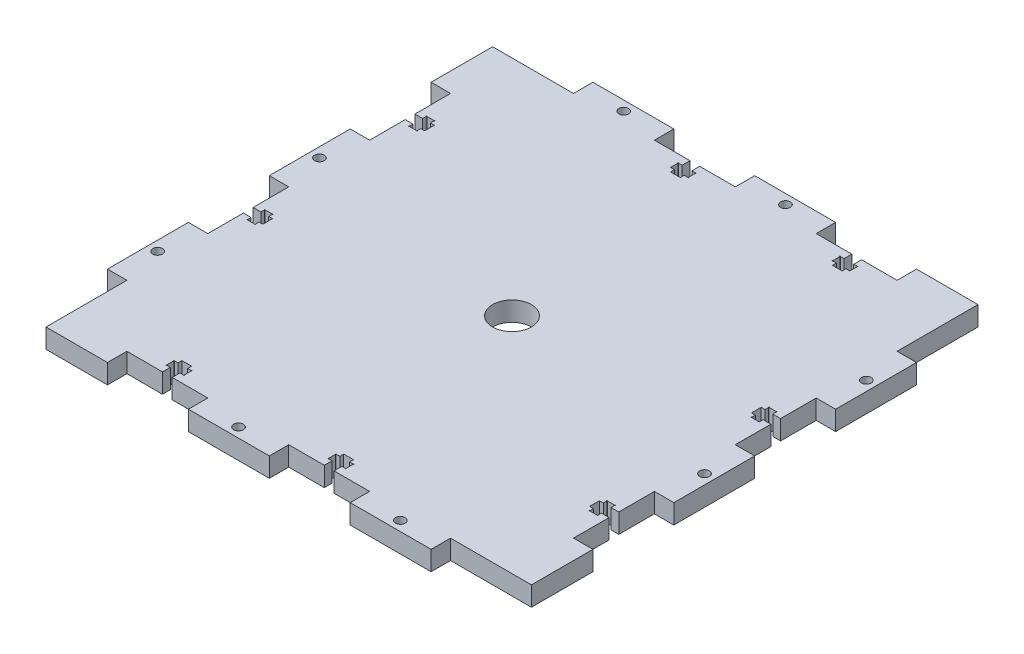
from build123d import *

# Parameters (mm, degrees)
BOSS_EXTRUDE1_DEPTH = 6
SKETCH2_R           = 1.5
CUT_EXTRUDE1_DEPTH  = 107.235587258
SKETCH3_R           = 6
CUT_EXTRUDE2_DEPTH  = 107.235587258


with BuildPart() as part:
    # Sketch1 → Boss-Extrude1 (new body)
    with BuildSketch(Plane(origin=(0, 0, 0), x_dir=(1, 0, 0), z_dir=(0, 1, 0))):
        Polygon((0, 75), (25, 75), (25, 69), (50, 69), (50, 75), (69, 75), (69, 50), (75, 50), (75, 25), (69, 25), (69, 0), (75, 0), (75, -25), (69, -25), (69, -50), (75, -50), (75, -69), (50, -69), (50, -75), (25, -75), (25, -69), (0, -69), (0, -75), (-25, -75), (-25, -69), (-50, -69), (-50, -75), (-69, -75), (-69, -50), (-75, -50), (-75, -25), (-69, -25), (-69, 0), (-75, 0), (-75, 25), (-69, 25), (-69, 50), (-75, 50), (-75, 69), (-50, 69), (-50, 75), (-25, 75), (-25, 69), (0, 69), align=None)
    extrude(amount=BOSS_EXTRUDE1_DEPTH)

    # Sketch2 → Cut-Extrude1 (cut, through all)
    with BuildSketch(Plane(origin=(0, 6, 0), x_dir=(1, 0, 0), z_dir=(0, 1, 0))):
        with Locations(Location((-37.5, 72, 0), (0, 0, 270))):
            Circle(SKETCH2_R)
        with Locations(Location((12.5, 72, 0), (0, 0, 270))):
            Circle(SKETCH2_R)
        with Locations(Location((72, 37.5, 0), (0, 0, 270))):
            Circle(SKETCH2_R)
        with Locations(Location((72, -12.5, 0), (0, 0, 270))):
            Circle(SKETCH2_R)
        with Locations(Location((37.5, -72, 0), (0, 0, 270))):
            Circle(SKETCH2_R)
        with Locations(Location((-12.5, -72, 0), (0, 0, 270))):
            Circle(SKETCH2_R)
        with Locations(Location((-72, -37.5, 0), (0, 0, 270))):
            Circle(SKETCH2_R)
        with Locations(Location((-72, 12.5, 0), (0, 0, 270))):
            Circle(SKETCH2_R)
        with BuildLine():
            Line((-11, 69), (-14, 69))
            Line((-14, 69), (-14, 66.6))
            Line((-14, 66.6), (-15.1, 66.6))
            ThreePointArc((-15.1, 66.6), (-15.270710678, 66.670710678), (-15.2, 66.5))
            Line((-15.2, 66.5), (-15.2, 64.3))
            ThreePointArc((-15.2, 64.3), (-15.270710678, 64.129289322), (-15.1, 64.2))
            Line((-15.1, 64.2), (-14, 64.2))
            Line((-14, 64.2), (-14, 63))
            Line((-14, 63), (-11, 63))
            Line((-11, 63), (-11, 64.2))
            Line((-11, 64.2), (-9.9, 64.2))
            ThreePointArc((-9.9, 64.2), (-9.729289322, 64.129289322), (-9.8, 64.3))
            Line((-9.8, 64.3), (-9.8, 66.5))
            ThreePointArc((-9.8, 66.5), (-9.729289322, 66.670710678), (-9.9, 66.6))
            Line((-9.9, 66.6), (-11, 66.6))
            Line((-11, 66.6), (-11, 69))
        make_face()
        with BuildLine():
            Line((69, 11), (69, 14))
            Line((69, 14), (66.6, 14))
            Line((66.6, 14), (66.6, 15.1))
            ThreePointArc((66.6, 15.1), (66.670710678, 15.270710678), (66.5, 15.2))
            Line((66.5, 15.2), (64.3, 15.2))
            ThreePointArc((64.3, 15.2), (64.129289322, 15.270710678), (64.2, 15.1))
            Line((64.2, 15.1), (64.2, 14))
            Line((64.2, 14), (63, 14))
            Line((63, 14), (63, 11))
            Line((63, 11), (64.2, 11))
            Line((64.2, 11), (64.2, 9.9))
            ThreePointArc((64.2, 9.9), (64.129289322, 9.729289322), (64.3, 9.8))
            Line((64.3, 9.8), (66.5, 9.8))
            ThreePointArc((66.5, 9.8), (66.670710678, 9.729289322), (66.6, 9.9))
            Line((66.6, 9.9), (66.6, 11))
            Line((66.6, 11), (69, 11))
        make_face()
        with BuildLine():
            Line((39, 69), (36, 69))
            Line((36, 69), (36, 66.6))
            Line((36, 66.6), (34.9, 66.6))
            ThreePointArc((34.9, 66.6), (34.729289322, 66.670710678), (34.8, 66.5))
            Line((34.8, 66.5), (34.8, 64.3))
            ThreePointArc((34.8, 64.3), (34.729289322, 64.129289322), (34.9, 64.2))
            Line((34.9, 64.2), (36, 64.2))
            Line((36, 64.2), (36, 63))
            Line((36, 63), (39, 63))
            Line((39, 63), (39, 64.2))
            Line((39, 64.2), (40.1, 64.2))
            ThreePointArc((40.1, 64.2), (40.270710678, 64.129289322), (40.2, 64.3))
            Line((40.2, 64.3), (40.2, 66.5))
            ThreePointArc((40.2, 66.5), (40.270710678, 66.670710678), (40.1, 66.6))
            Line((40.1, 66.6), (39, 66.6))
            Line((39, 66.6), (39, 69))
        make_face()
        with BuildLine():
            Line((69, -39), (69, -36))
            Line((69, -36), (66.6, -36))
            Line((66.6, -36), (66.6, -34.9))
            ThreePointArc((66.6, -34.9), (66.670710678, -34.729289322), (66.5, -34.8))
            Line((66.5, -34.8), (64.3, -34.8))
            ThreePointArc((64.3, -34.8), (64.129289322, -34.729289322), (64.2, -34.9))
            Line((64.2, -34.9), (64.2, -36))
            Line((64.2, -36), (63, -36))
            Line((63, -36), (63, -39))
            Line((63, -39), (64.2, -39))
            Line((64.2, -39), (64.2, -40.1))
            ThreePointArc((64.2, -40.1), (64.129289322, -40.270710678), (64.3, -40.2))
            Line((64.3, -40.2), (66.5, -40.2))
            ThreePointArc((66.5, -40.2), (66.670710678, -40.270710678), (66.6, -40.1))
            Line((66.6, -40.1), (66.6, -39))
            Line((66.6, -39), (69, -39))
        make_face()
        with BuildLine():
            Line((11, -69), (14, -69))
            Line((14, -69), (14, -66.6))
            Line((14, -66.6), (15.1, -66.6))
            ThreePointArc((15.1, -66.6), (15.270710678, -66.670710678), (15.2, -66.5))
            Line((15.2, -66.5), (15.2, -64.3))
            ThreePointArc((15.2, -64.3), (15.270710678, -64.129289322), (15.1, -64.2))
            Line((15.1, -64.2), (14, -64.2))
            Line((14, -64.2), (14, -63))
            Line((14, -63), (11, -63))
            Line((11, -63), (11, -64.2))
            Line((11, -64.2), (9.9, -64.2))
            ThreePointArc((9.9, -64.2), (9.729289322, -64.129289322), (9.8, -64.3))
            Line((9.8, -64.3), (9.8, -66.5))
            ThreePointArc((9.8, -66.5), (9.729289322, -66.670710678), (9.9, -66.6))
            Line((9.9, -66.6), (11, -66.6))
            Line((11, -66.6), (11, -69))
        make_face()
        with BuildLine():
            Line((-39, -69), (-36, -69))
            Line((-36, -69), (-36, -66.6))
            Line((-36, -66.6), (-34.9, -66.6))
            ThreePointArc((-34.9, -66.6), (-34.729289322, -66.670710678), (-34.8, -66.5))
            Line((-34.8, -66.5), (-34.8, -64.3))
            ThreePointArc((-34.8, -64.3), (-34.729289322, -64.129289322), (-34.9, -64.2))
            Line((-34.9, -64.2), (-36, -64.2))
            Line((-36, -64.2), (-36, -63))
            Line((-36, -63), (-39, -63))
            Line((-39, -63), (-39, -64.2))
            Line((-39, -64.2), (-40.1, -64.2))
            ThreePointArc((-40.1, -64.2), (-40.270710678, -64.129289322), (-40.2, -64.3))
            Line((-40.2, -64.3), (-40.2, -66.5))
            ThreePointArc((-40.2, -66.5), (-40.270710678, -66.670710678), (-40.1, -66.6))
            Line((-40.1, -66.6), (-39, -66.6))
            Line((-39, -66.6), (-39, -69))
        make_face()
        with BuildLine():
            Line((-69, 39), (-69, 36))
            Line((-69, 36), (-66.6, 36))
            Line((-66.6, 36), (-66.6, 34.9))
            ThreePointArc((-66.6, 34.9), (-66.670710678, 34.729289322), (-66.5, 34.8))
            Line((-66.5, 34.8), (-64.3, 34.8))
            ThreePointArc((-64.3, 34.8), (-64.129289322, 34.729289322), (-64.2, 34.9))
            Line((-64.2, 34.9), (-64.2, 36))
            Line((-64.2, 36), (-63, 36))
            Line((-63, 36), (-63, 39))
            Line((-63, 39), (-64.2, 39))
            Line((-64.2, 39), (-64.2, 40.1))
            ThreePointArc((-64.2, 40.1), (-64.129289322, 40.270710678), (-64.3, 40.2))
            Line((-64.3, 40.2), (-66.5, 40.2))
            ThreePointArc((-66.5, 40.2), (-66.670710678, 40.270710678), (-66.6, 40.1))
            Line((-66.6, 40.1), (-66.6, 39))
            Line((-66.6, 39), (-69, 39))
        make_face()
        with BuildLine():
            Line((-69, -11), (-69, -14))
            Line((-69, -14), (-66.6, -14))
            Line((-66.6, -14), (-66.6, -15.1))
            ThreePointArc((-66.6, -15.1), (-66.670710678, -15.270710678), (-66.5, -15.2))
            Line((-66.5, -15.2), (-64.3, -15.2))
            ThreePointArc((-64.3, -15.2), (-64.129289322, -15.270710678), (-64.2, -15.1))
            Line((-64.2, -15.1), (-64.2, -14))
            Line((-64.2, -14), (-63, -14))
            Line((-63, -14), (-63, -11))
            Line((-63, -11), (-64.2, -11))
            Line((-64.2, -11), (-64.2, -9.9))
            ThreePointArc((-64.2, -9.9), (-64.129289322, -9.729289322), (-64.3, -9.8))
            Line((-64.3, -9.8), (-66.5, -9.8))
            ThreePointArc((-66.5, -9.8), (-66.670710678, -9.729289322), (-66.6, -9.9))
            Line((-66.6, -9.9), (-66.6, -11))
            Line((-66.6, -11), (-69, -11))
        make_face()
    extrude(amount=-CUT_EXTRUDE1_DEPTH, mode=Mode.SUBTRACT)

    # Sketch3 → Cut-Extrude2 (cut, through all)
    with BuildSketch(Plane.XZ):
        with Locations(Location((0, 0, 0), (0, 0, 270))):
            Circle(SKETCH3_R)
    extrude(amount=-CUT_EXTRUDE2_DEPTH, mode=Mode.SUBTRACT)


solid = part.part
